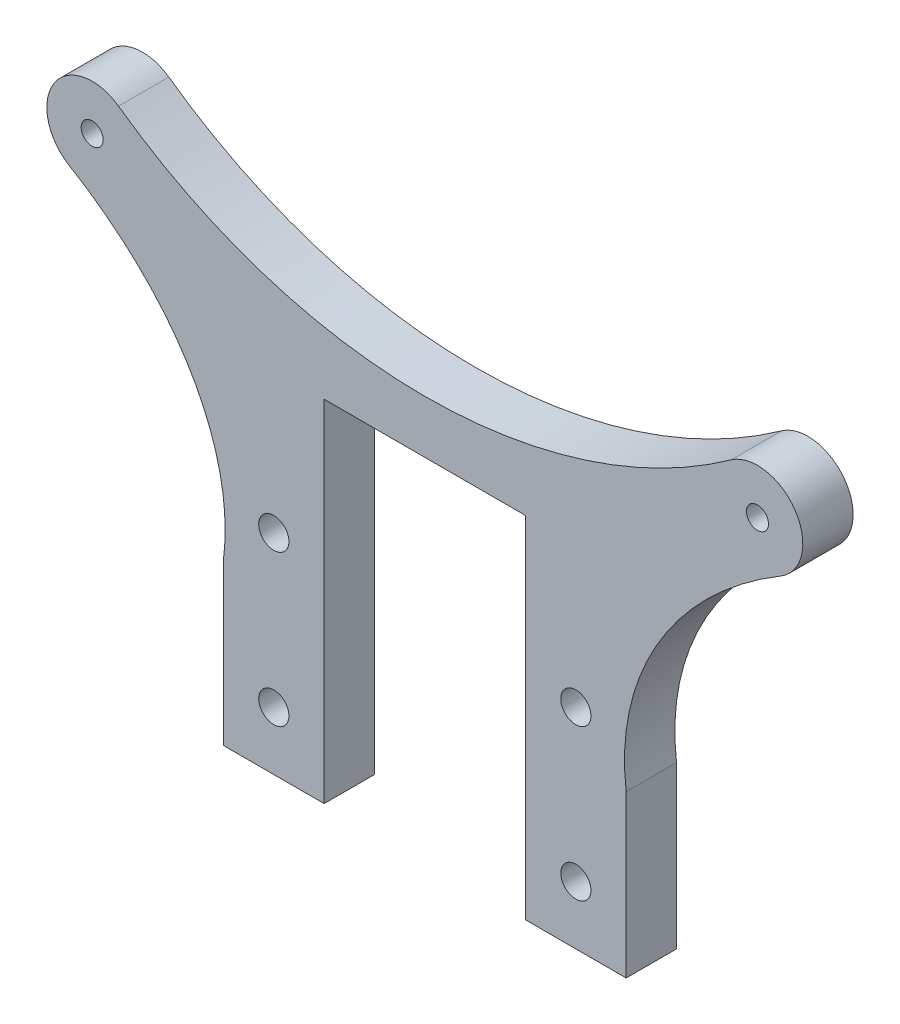
from build123d import *

# Parameters (mm, degrees)
SKETCH1_R           = 1.3890625
SKETCH1_R_2         = 1.905
BOSS_EXTRUDE1_DEPTH = 6.35


with BuildPart() as part:
    # Sketch1 → Boss-Extrude1 (new body)
    with BuildSketch(Plane.XY):
        with BuildLine():
            Line((-12.7, 0), (12.7, 0))
            Line((12.7, 0), (12.7, -44.17993629))
            Line((12.7, -44.17993629), (25.4, -44.17993629))
            Line((25.4, -44.17993629), (25.4, -23.822954819))
            add(Edge.make_bspline(
                [(44.901870562, 9.48833089), (22.852171125, -3.715928222), (25.4, -23.822954819)],
                knots=[5.247063621, 5.247063621, 5.247063621, 6.283185307, 6.283185307, 6.283185307], degree=2, weights=[1, 0.868781076, 1]))
            ThreePointArc((44.901870562, 9.48833089), (46.747333824, 17.526669162), (38.641141335, 19.046623163))
            ThreePointArc((38.641141335, 19.046623163), (0, 6.664444687), (-38.641141335, 19.046623163))
            ThreePointArc((-38.641141335, 19.046623163), (-46.747333824, 17.526669162), (-44.901870562, 9.48833089))
            add(Edge.make_bspline(
                [(-25.4, -23.822954819), (-22.852171125, -3.715928222), (-44.901870562, 9.48833089)],
                knots=[0, 0, 0, 1.036121686, 1.036121686, 1.036121686], degree=2, weights=[1, 0.868781076, 1]))
            Line((-25.4, -23.822954819), (-25.4, -44.17993629))
            Line((-25.4, -44.17993629), (-12.7, -44.17993629))
            Line((-12.7, -44.17993629), (-12.7, 0))
        make_face()
        with Locations(Location((41.964300524, 14.393758438, 0), (0, 0, 180))):
            Circle(SKETCH1_R, mode=Mode.SUBTRACT)
        with Locations((-41.964300524, 14.393758438)):
            Circle(SKETCH1_R, mode=Mode.SUBTRACT)
        with Locations((-19.05, -17.78)):
            Circle(SKETCH1_R_2, mode=Mode.SUBTRACT)
        with Locations((-19.05, -36.83)):
            Circle(SKETCH1_R_2, mode=Mode.SUBTRACT)
        with Locations(Location((19.05, -36.83, 0), (0, 0, 180))):
            Circle(SKETCH1_R_2, mode=Mode.SUBTRACT)
        with Locations(Location((19.05, -17.78, 0), (0, 0, 180))):
            Circle(SKETCH1_R_2, mode=Mode.SUBTRACT)
    extrude(amount=BOSS_EXTRUDE1_DEPTH)


solid = part.part
